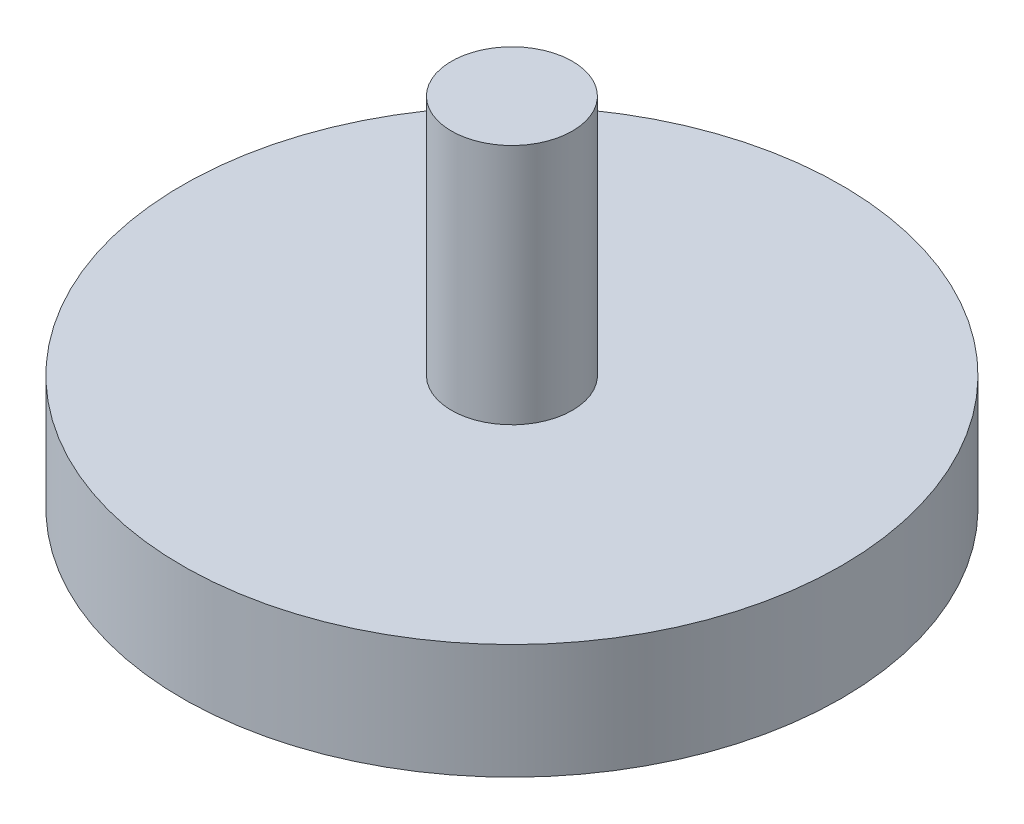
from build123d import *

# Parameters (mm, degrees)
SCHIZZO3_W                   = 15
SCHIZZO3_H                   = 45
ESTRUSIONE_ESTRUSIONE1_DEPTH = 25


with BuildPart() as part:
    # Schizzo1 → Rivoluzione1 (revolve)
    with BuildSketch(Plane.XY):
        Polygon((20, 68), (109, 68), (109, 30), (30, 30), (30, 5), (48, 5), (48, 0), (0, 0), (0, 148), (20, 148), align=None)
    revolve(axis=Axis((0, -1000, 0), (0, 1, 0)))

    # Schizzo3 → Estrusione-Estrusione1 (add)
    with BuildSketch(Plane.XZ.offset(-30)):
        with Locations((0, 22.5)):
            Rectangle(SCHIZZO3_W, SCHIZZO3_H)
    extrude(amount=ESTRUSIONE_ESTRUSIONE1_DEPTH)


solid = part.part
